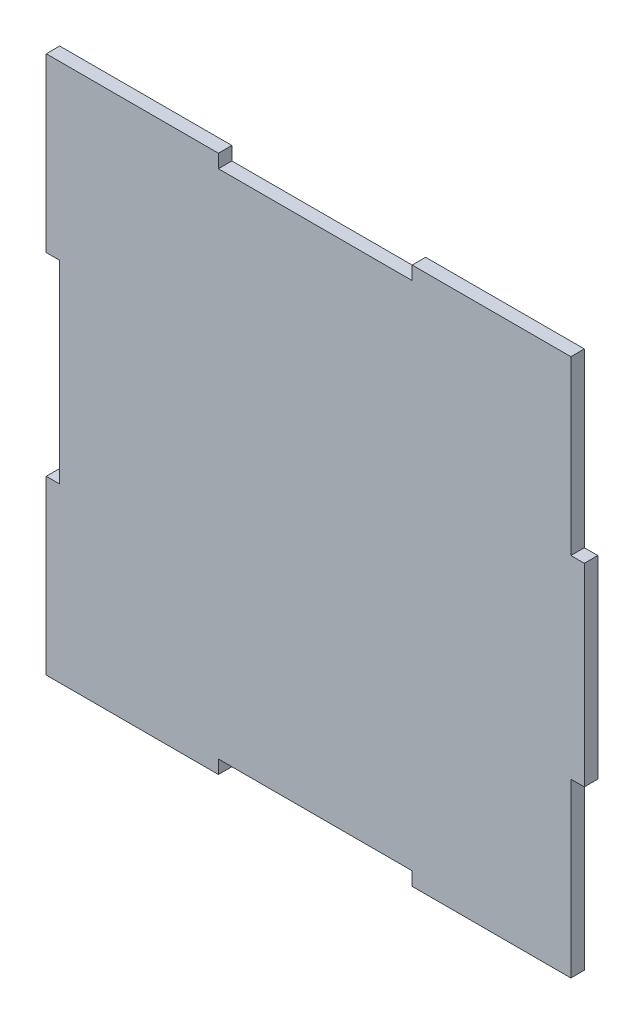
from build123d import *

# Parameters (mm, degrees)
BOSS_EXTRUDE1_DEPTH = 5


with BuildPart() as part:
    # Sketch1 → Boss-Extrude1 (new body)
    with BuildSketch(Plane.XY):
        Polygon((36, 95), (-36, 95), (-36, 100), (-100, 100), (-100, 36), (-95, 36), (-95, -36), (-100, -36), (-100, -100), (-36, -100), (-36, -95), (36, -95), (36, -100), (95, -100), (95, -36), (100, -36), (100, 36), (95, 36), (95, 100), (36, 100), align=None)
    extrude(amount=BOSS_EXTRUDE1_DEPTH)


solid = part.part
